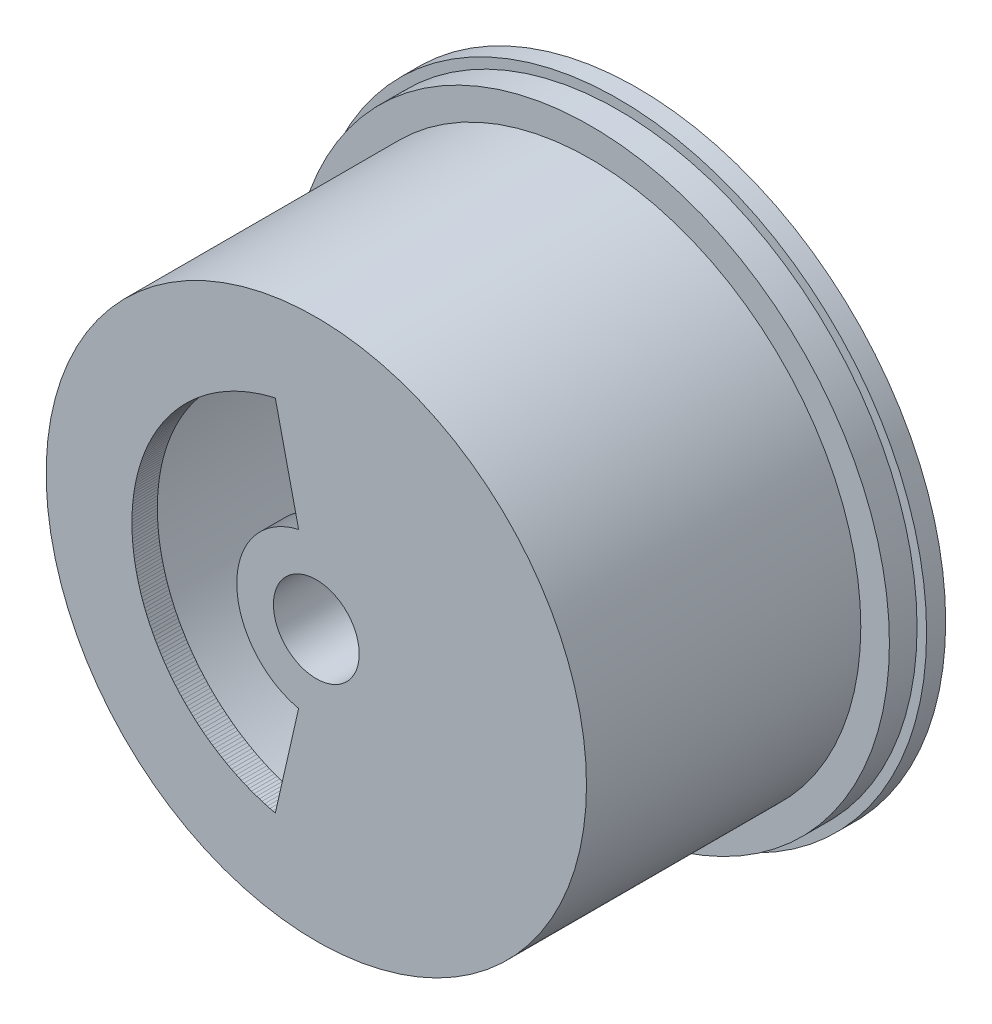
from build123d import *

# Parameters (mm, degrees)
SKETCH_1_R             = 97
F_01_FLANGE_D194_DEPTH = 6
SKETCH_2_R             = 94
F_02_SPIGOT_D188_DEPTH = 8.7
SKETCH_3_R             = 85
F_03_BODY_D170_DEPTH   = 86.3
SKETCH_4_R             = 79
F_04_BORE_D158_DEPTH   = 6
SKETCH_5_R             = 75
F_05_BORE_D150_DEPTH   = 87
SKETCH_6_R             = 21
F_06_BOSS_D42_DEPTH    = 5
SKETCH_7_R             = 15
F_07_BOSS_D30_DEPTH    = 7
SKETCH_8_R             = 13.5
F_08_BORE_D27_DEPTH    = 20
F_09_FAN_WINDOW_DEPTH  = 8
SKETCH_10_R            = 2.1
F_10_HOLES_24_M5_DEPTH = 6


with BuildPart() as part:
    # 草图1 → 01_FLANGE_D194 (new body)
    with BuildSketch(Plane.XY):
        Circle(SKETCH_1_R)
    extrude(amount=F_01_FLANGE_D194_DEPTH)

    # 草图2 → 02_SPIGOT_D188 (add)
    with BuildSketch(Plane.XY.offset(6)):
        Circle(SKETCH_2_R)
    extrude(amount=F_02_SPIGOT_D188_DEPTH)

    # 草图3 → 03_BODY_D170 (add)
    with BuildSketch(Plane.XY.offset(14.7)):
        Circle(SKETCH_3_R)
    extrude(amount=F_03_BODY_D170_DEPTH)

    # 草图4 → 04_BORE_D158 (cut)
    with BuildSketch(Plane.XY):
        Circle(SKETCH_4_R)
    extrude(amount=F_04_BORE_D158_DEPTH, mode=Mode.SUBTRACT)

    # 草图5 → 05_BORE_D150 (cut)
    with BuildSketch(Plane.XY.offset(6)):
        Circle(SKETCH_5_R)
    extrude(amount=F_05_BORE_D150_DEPTH, mode=Mode.SUBTRACT)

    # 草图6 → 06_BOSS_D42 (add)
    with BuildSketch(Plane.XY.offset(88)):
        Circle(SKETCH_6_R)
    extrude(amount=F_06_BOSS_D42_DEPTH)

    # 草图7 → 07_BOSS_D30 (add)
    with BuildSketch(Plane.XY.offset(81)):
        Circle(SKETCH_7_R)
    extrude(amount=F_07_BOSS_D30_DEPTH)

    # 草图8 → 08_BORE_D27 (cut)
    with BuildSketch(Plane.XY.offset(81)):
        Circle(SKETCH_8_R)
    extrude(amount=F_08_BORE_D27_DEPTH, mode=Mode.SUBTRACT)

    # 草图9 → 09_FAN_WINDOW (cut)
    with BuildSketch(Plane.XY.offset(93)):
        Polygon((-12.899164707, 56.547427438), (-13.743715349, 56.348116991), (-14.585189627, 56.136193704), (-15.423399189, 55.911705013), (-16.25815641, 55.674701168), (-17.089274441, 55.425235219), (-17.916567246, 55.163363006), (-18.739849646, 54.889143146), (-19.558937358, 54.602637019), (-20.373647041, 54.303908757), (-21.18379633, 53.993025226), (-21.989203885, 53.670056014), (-22.789689424, 53.335073413), (-23.585073769, 52.988152405), (-24.375178882, 52.629370645), (-25.159827908, 52.258808441), (-25.938845213, 51.876548739), (-26.712056423, 51.482677103), (-27.479288464, 51.077281696), (-28.240369602, 50.660453262), (-28.995129477, 50.232285103), (-29.743399144, 49.792873058), (-30.485011114, 49.342315484), (-31.219799386, 48.880713234), (-31.947599486, 48.408169632), (-32.668248504, 47.92479045), (-33.381585133, 47.430683887), (-34.0874497, 46.925960544), (-34.785684207, 46.410733395), (-35.476132362, 45.885117769), (-36.158639617, 45.349231317), (-36.8330532, 44.803193993), (-37.499222153, 44.247128019), (-38.156997361, 43.681157864), (-38.806231591, 43.105410214), (-39.446779518, 42.520013943), (-40.078497763, 41.925100084), (-40.701244925, 41.320801802), (-41.314881609, 40.707254362), (-41.919270459, 40.084595098), (-42.514276191, 39.452963386), (-43.099765621, 38.812500608), (-43.675607692, 38.163350125), (-44.24167351, 37.50565724), (-44.797836369, 36.839569171), (-45.343971777, 36.165235012), (-45.879957489, 35.482805706), (-46.405673531, 34.792434007), (-46.921002229, 34.094274444), (-47.425828231, 33.388483293), (-47.920038539, 32.675218537), (-48.40352253, 31.954639831), (-48.876171982, 31.226908467), (-49.337881097, 30.492187341), (-49.788546529, 29.75064091), (-50.228067401, 29.00243516), (-50.656345331, 28.247737567), (-51.073284456, 27.486717063), (-51.478791447, 26.719543992), (-51.872775538, 25.946390076), (-52.255148539, 25.167428377), (-52.625824862, 24.382833256), (-52.984721535, 23.592780334), (-53.331758223, 22.797446455), (-53.666857246, 21.997009646), (-53.989943596, 21.191649073), (-54.300944956, 20.381545009), (-54.599791709, 19.566878783), (-54.886416964, 18.74783275), (-55.160756563, 17.924590243), (-55.422749098, 17.097335534), (-55.672335926, 16.266253795), (-55.909461179, 15.431531054), (-56.13407178, 14.593354152), (-56.346117452, 13.751910705), (-56.545550733, 12.90738906), (-56.73232698, 12.059978254), (-56.906404386, 11.209867968), (-57.067743987, 10.35724849), (-57.216309667, 9.502310668), (-57.352068174, 8.64524587), (-57.474989119, 7.786245938), (-57.585044987, 6.92550315), (-57.682211144, 6.063210172), (-57.76646584, 5.199560019), (-57.837790216, 4.334746007), (-57.896168307, 3.468961716), (-57.941587046, 2.602400939), (-57.974036265, 1.735257647), (-57.993508703, 0.867725938), (-58, 0), (-57.993508703, -0.867725938), (-57.974036265, -1.735257647), (-57.941587046, -2.602400939), (-57.896168307, -3.468961716), (-57.837790216, -4.334746007), (-57.76646584, -5.199560019), (-57.682211144, -6.063210172), (-57.585044987, -6.92550315), (-57.474989119, -7.786245938), (-57.352068174, -8.64524587), (-57.216309667, -9.502310668), (-57.067743987, -10.35724849), (-56.906404386, -11.209867968), (-56.73232698, -12.059978254), (-56.545550733, -12.90738906), (-56.346117452, -13.751910705), (-56.13407178, -14.593354152), (-55.909461179, -15.431531054), (-55.672335926, -16.266253795), (-55.422749098, -17.097335534), (-55.160756563, -17.924590243), (-54.886416964, -18.74783275), (-54.599791709, -19.566878783), (-54.300944956, -20.381545009), (-53.989943596, -21.191649073), (-53.666857246, -21.997009646), (-53.331758223, -22.797446455), (-52.984721535, -23.592780334), (-52.625824862, -24.382833256), (-52.255148539, -25.167428377), (-51.872775538, -25.946390076), (-51.478791447, -26.719543992), (-51.073284456, -27.486717063), (-50.656345331, -28.247737567), (-50.228067401, -29.00243516), (-49.788546529, -29.75064091), (-49.337881097, -30.492187341), (-48.876171982, -31.226908467), (-48.40352253, -31.954639831), (-47.920038539, -32.675218537), (-47.425828231, -33.388483293), (-46.921002229, -34.094274444), (-46.405673531, -34.792434007), (-45.879957489, -35.482805706), (-45.343971777, -36.165235012), (-44.797836369, -36.839569171), (-44.24167351, -37.50565724), (-43.675607692, -38.163350125), (-43.099765621, -38.812500608), (-42.514276191, -39.452963386), (-41.919270459, -40.084595098), (-41.314881609, -40.707254362), (-40.701244925, -41.320801802), (-40.078497763, -41.925100084), (-39.446779518, -42.520013943), (-38.806231591, -43.105410214), (-38.156997361, -43.681157864), (-37.499222153, -44.247128019), (-36.8330532, -44.803193993), (-36.158639617, -45.349231317), (-35.476132362, -45.885117769), (-34.785684207, -46.410733395), (-34.0874497, -46.925960544), (-33.381585133, -47.430683887), (-32.668248504, -47.92479045), (-31.947599486, -48.408169632), (-31.219799386, -48.880713234), (-30.485011114, -49.342315484), (-29.743399144, -49.792873058), (-28.995129477, -50.232285103), (-28.240369602, -50.660453262), (-27.479288464, -51.077281696), (-26.712056423, -51.482677103), (-25.938845213, -51.876548739), (-25.159827908, -52.258808441), (-24.375178882, -52.629370645), (-23.585073769, -52.988152405), (-22.789689424, -53.335073413), (-21.989203885, -53.670056014), (-21.18379633, -53.993025226), (-20.373647041, -54.303908757), (-19.558937358, -54.602637019), (-18.739849646, -54.889143146), (-17.916567246, -55.163363006), (-17.089274441, -55.425235219), (-16.25815641, -55.674701168), (-15.423399189, -55.911705013), (-14.585189627, -56.136193704), (-13.743715349, -56.348116991), (-12.899164707, -56.547427438), (-5.559984787, -24.373891137), (-5.924015237, -24.287981462), (-6.286719667, -24.196635217), (-6.648016892, -24.09987285), (-7.007826039, -23.997716021), (-7.36606657, -23.890187594), (-7.722658296, -23.77731164), (-8.077521399, -23.659113425), (-8.430576448, -23.535619405), (-8.781744414, -23.406857223), (-9.130946694, -23.272855701), (-9.478105123, -23.133644833), (-9.823141993, -22.989255781), (-10.165980073, -22.839720864), (-10.506542621, -22.685073554), (-10.844753409, -22.525348466), (-11.18053673, -22.360581353), (-11.513817424, -22.190809096), (-11.84452089, -22.016069697), (-12.172573104, -21.836402268), (-12.497900636, -21.651847027), (-12.820430666, -21.462445283), (-13.140090998, -21.268239433), (-13.45681008, -21.069272946), (-13.77051702, -20.865590359), (-14.081141597, -20.657237263), (-14.388614281, -20.444260296), (-14.69286625, -20.226707131), (-14.9938294, -20.004626463), (-15.291436363, -19.778068004), (-15.585620524, -19.547082464), (-15.876316034, -19.311721549), (-16.163457824, -19.072037939), (-16.446981621, -18.828085286), (-16.726823962, -18.579918196), (-17.002922206, -18.327592217), (-17.275214553, -18.071163829), (-17.543640054, -17.810690432), (-17.808138624, -17.546230328), (-18.06865106, -17.277842715), (-18.325119048, -17.005587666), (-18.577485181, -16.729526124), (-18.825692971, -16.449719881), (-19.069686858, -16.166231569), (-19.309412228, -15.879124643), (-19.544815421, -15.588463367), (-19.775843745, -15.294312805), (-20.002445488, -14.996738796), (-20.224569926, -14.69580795), (-20.442167341, -14.391587626), (-20.655189025, -14.084145921), (-20.863587297, -13.773551651), (-21.067315509, -13.459874339), (-21.266328059, -13.143184199), (-21.4605804, -12.823552116), (-21.650029052, -12.501049638), (-21.834631608, -12.175748951), (-22.014346748, -11.847722872), (-22.189134244, -11.517044824), (-22.358954973, -11.183788826), (-22.523770922, -10.848029473), (-22.683545199, -10.50984192), (-22.838242041, -10.169301868), (-22.98782682, -9.826485541), (-23.132266054, -9.481469675), (-23.271527412, -9.134331497), (-23.405579722, -8.785148711), (-23.534392978, -8.433999475), (-23.657938347, -8.080962392), (-23.776188174, -7.726116484), (-23.889115991, -7.369541179), (-23.99669652, -7.011316291), (-24.098905681, -6.651522006), (-24.195720595, -6.290238858), (-24.287119592, -5.927547718), (-24.373082212, -5.563529767), (-24.453589215, -5.198266489), (-24.52862258, -4.831839642), (-24.598165511, -4.464331246), (-24.662202443, -4.095823564), (-24.720719041, -3.726399082), (-24.773702206, -3.35614049), (-24.82114008, -2.985130668), (-24.863022045, -2.61345266), (-24.899338724, -2.241189663), (-24.93008199, -1.868425003), (-24.95524496, -1.495242119), (-24.974822002, -1.121724543), (-24.988808735, -0.747955882), (-24.997202027, -0.374019801), (-25, 0), (-24.997202027, 0.374019801), (-24.988808735, 0.747955882), (-24.974822002, 1.121724543), (-24.95524496, 1.495242119), (-24.93008199, 1.868425003), (-24.899338724, 2.241189663), (-24.863022045, 2.61345266), (-24.82114008, 2.985130668), (-24.773702206, 3.35614049), (-24.720719041, 3.726399082), (-24.662202443, 4.095823564), (-24.598165511, 4.464331246), (-24.52862258, 4.831839642), (-24.453589215, 5.198266489), (-24.373082212, 5.563529767), (-24.287119592, 5.927547718), (-24.195720595, 6.290238858), (-24.098905681, 6.651522006), (-23.99669652, 7.011316291), (-23.889115991, 7.369541179), (-23.776188174, 7.726116484), (-23.657938347, 8.080962392), (-23.534392978, 8.433999475), (-23.405579722, 8.785148711), (-23.271527412, 9.134331497), (-23.132266054, 9.481469675), (-22.98782682, 9.826485541), (-22.838242041, 10.169301868), (-22.683545199, 10.50984192), (-22.523770922, 10.848029473), (-22.358954973, 11.183788826), (-22.189134244, 11.517044824), (-22.014346748, 11.847722872), (-21.834631608, 12.175748951), (-21.650029052, 12.501049638), (-21.4605804, 12.823552116), (-21.266328059, 13.143184199), (-21.067315509, 13.459874339), (-20.863587297, 13.773551651), (-20.655189025, 14.084145921), (-20.442167341, 14.391587626), (-20.224569926, 14.69580795), (-20.002445488, 14.996738796), (-19.775843745, 15.294312805), (-19.544815421, 15.588463367), (-19.309412228, 15.879124643), (-19.069686858, 16.166231569), (-18.825692971, 16.449719881), (-18.577485181, 16.729526124), (-18.325119048, 17.005587666), (-18.06865106, 17.277842715), (-17.808138624, 17.546230328), (-17.543640054, 17.810690432), (-17.275214553, 18.071163829), (-17.002922206, 18.327592217), (-16.726823962, 18.579918196), (-16.446981621, 18.828085286), (-16.163457824, 19.072037939), (-15.876316034, 19.311721549), (-15.585620524, 19.547082464), (-15.291436363, 19.778068004), (-14.9938294, 20.004626463), (-14.69286625, 20.226707131), (-14.388614281, 20.444260296), (-14.081141597, 20.657237263), (-13.77051702, 20.865590359), (-13.45681008, 21.069272946), (-13.140090998, 21.268239433), (-12.820430666, 21.462445283), (-12.497900636, 21.651847027), (-12.172573104, 21.836402268), (-11.84452089, 22.016069697), (-11.513817424, 22.190809096), (-11.18053673, 22.360581353), (-10.844753409, 22.525348466), (-10.506542621, 22.685073554), (-10.165980073, 22.839720864), (-9.823141993, 22.989255781), (-9.478105123, 23.133644833), (-9.130946694, 23.272855701), (-8.781744414, 23.406857223), (-8.430576448, 23.535619405), (-8.077521399, 23.659113425), (-7.722658296, 23.77731164), (-7.36606657, 23.890187594), (-7.007826039, 23.997716021), (-6.648016892, 24.09987285), (-6.286719667, 24.196635217), (-5.924015237, 24.287981462), (-5.559984787, 24.373891137), align=None)
    extrude(amount=F_09_FAN_WINDOW_DEPTH, mode=Mode.SUBTRACT)

    # 草图10 → 10_HOLES_24_M5 (cut)
    with BuildSketch(Plane.XY):
        with Locations((90.221482385, 11.877883492)):
            Circle(SKETCH_10_R)
        with Locations((84.073037459, 34.824192345)):
            Circle(SKETCH_10_R)
        with Locations((72.195153967, 55.39729004)):
            Circle(SKETCH_10_R)
        with Locations((55.39729004, 72.195153967)):
            Circle(SKETCH_10_R)
        with Locations((34.824192345, 84.073037459)):
            Circle(SKETCH_10_R)
        with Locations((11.877883492, 90.221482385)):
            Circle(SKETCH_10_R)
        with Locations((-11.877883492, 90.221482385)):
            Circle(SKETCH_10_R)
        with Locations((-34.824192345, 84.073037459)):
            Circle(SKETCH_10_R)
        with Locations((-55.39729004, 72.195153967)):
            Circle(SKETCH_10_R)
        with Locations((-72.195153967, 55.39729004)):
            Circle(SKETCH_10_R)
        with Locations((-84.073037459, 34.824192345)):
            Circle(SKETCH_10_R)
        with Locations((-90.221482385, 11.877883492)):
            Circle(SKETCH_10_R)
        with Locations((-90.221482385, -11.877883492)):
            Circle(SKETCH_10_R)
        with Locations((-84.073037459, -34.824192345)):
            Circle(SKETCH_10_R)
        with Locations((-72.195153967, -55.39729004)):
            Circle(SKETCH_10_R)
        with Locations((-55.39729004, -72.195153967)):
            Circle(SKETCH_10_R)
        with Locations((-34.824192345, -84.073037459)):
            Circle(SKETCH_10_R)
        with Locations((-11.877883492, -90.221482385)):
            Circle(SKETCH_10_R)
        with Locations((11.877883492, -90.221482385)):
            Circle(SKETCH_10_R)
        with Locations((34.824192345, -84.073037459)):
            Circle(SKETCH_10_R)
        with Locations((55.39729004, -72.195153967)):
            Circle(SKETCH_10_R)
        with Locations((72.195153967, -55.39729004)):
            Circle(SKETCH_10_R)
        with Locations((84.073037459, -34.824192345)):
            Circle(SKETCH_10_R)
        with Locations((90.221482385, -11.877883492)):
            Circle(SKETCH_10_R)
    extrude(amount=F_10_HOLES_24_M5_DEPTH, mode=Mode.SUBTRACT)


solid = part.part
